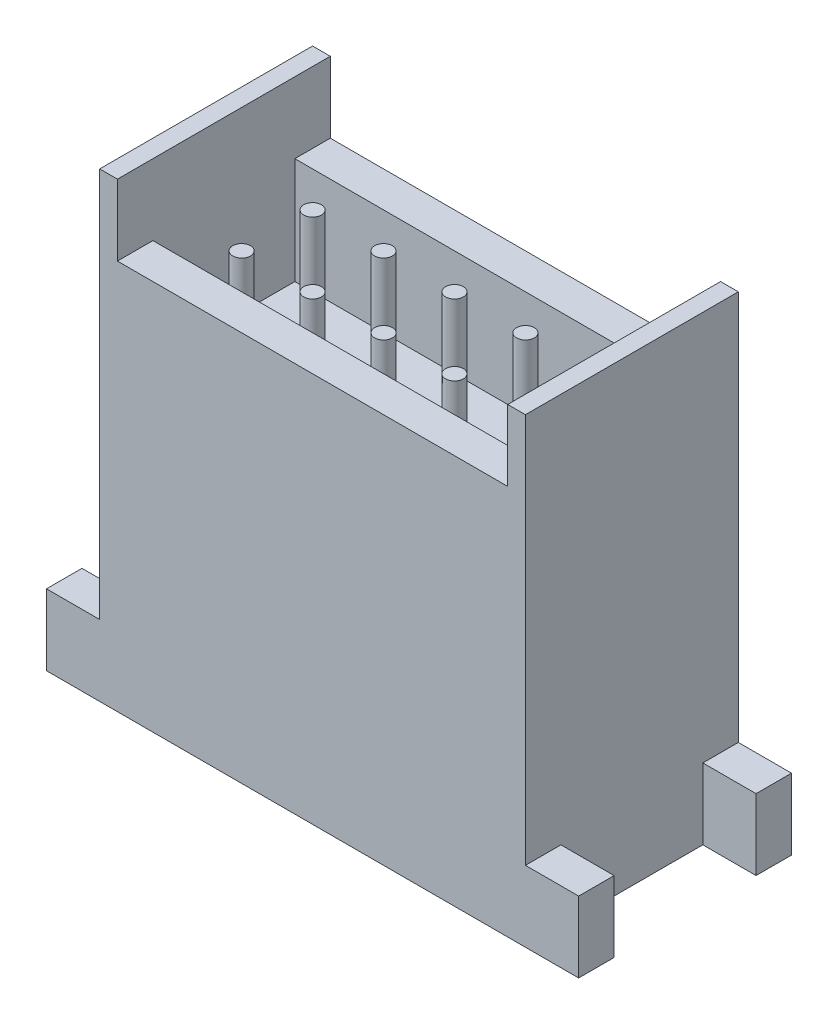
from build123d import *

# Parameters (mm, degrees)
SKETCH1_W           = 12
SKETCH1_H           = 6
BOSS_EXTRUDE1_DEPTH = 13
SKETCH2_W           = 1
SKETCH2_H           = 2
BOSS_EXTRUDE2_DEPTH = 1.5
SKETCH3_W           = 11
SKETCH3_H           = 4
CUT_EXTRUDE1_DEPTH  = 5
SKETCH4_W           = 11
SKETCH4_H           = 1
CUT_EXTRUDE2_DEPTH  = 2
SKETCH5_R           = 0.25
BOSS_EXTRUDE3_DEPTH = 3


with BuildPart() as part:
    # Sketch1 → Boss-Extrude1 (new body)
    with BuildSketch(Plane(origin=(0, 0, 0), x_dir=(1, 0, 0), z_dir=(0, 1, 0))):
        Rectangle(SKETCH1_W, SKETCH1_H)
    extrude(amount=BOSS_EXTRUDE1_DEPTH)

    # Sketch2 → Boss-Extrude2 (add)
    with BuildSketch(Plane(origin=(6, 0, 0), x_dir=(0, 0, -1), z_dir=(1, 0, 0))):
        with Locations((-2.5, 1)):
            Rectangle(SKETCH2_W, SKETCH2_H)
        with Locations((2.5, 1)):
            Rectangle(SKETCH2_W, SKETCH2_H)
    boss_extrude2 = extrude(amount=BOSS_EXTRUDE2_DEPTH)

    # Mirror1: Boss-Extrude2 across plane
    add(boss_extrude2.mirror(Plane(origin=(0, 0, 0), x_dir=(0, 0, 1), z_dir=(1, 0, 0))))

    # Sketch3 → Cut-Extrude1 (cut)
    with BuildSketch(Plane(origin=(0, 13, 0), x_dir=(1, 0, 0), z_dir=(0, 1, 0))):
        Rectangle(SKETCH3_W, SKETCH3_H)
    extrude(amount=-CUT_EXTRUDE1_DEPTH, mode=Mode.SUBTRACT)

    # Sketch4 → Cut-Extrude2 (cut)
    with BuildSketch(Plane(origin=(0, 13, 0), x_dir=(1, 0, 0), z_dir=(0, 1, 0))):
        with Locations((0, 2.5)):
            Rectangle(SKETCH4_W, SKETCH4_H)
        with Locations((0, -2.5)):
            Rectangle(SKETCH4_W, SKETCH4_H)
    extrude(amount=-CUT_EXTRUDE2_DEPTH, mode=Mode.SUBTRACT)

    # Sketch5 → Boss-Extrude3 (add)
    with BuildSketch(Plane(origin=(0, 8, 0), x_dir=(1, 0, 0), z_dir=(0, 1, 0))):
        with Locations((0, 1)):
            Circle(SKETCH5_R)
        with Locations((2, 1)):
            Circle(SKETCH5_R)
        with Locations((4, 1)):
            Circle(SKETCH5_R)
        with Locations((-4, 1)):
            Circle(SKETCH5_R)
        with Locations((-2, 1)):
            Circle(SKETCH5_R)
        with Locations((4, -1)):
            Circle(SKETCH5_R)
        with Locations((2, -1)):
            Circle(SKETCH5_R)
        with Locations((0, -1)):
            Circle(SKETCH5_R)
        with Locations((-2, -1)):
            Circle(SKETCH5_R)
        with Locations((-4, -1)):
            Circle(SKETCH5_R)
    extrude(amount=BOSS_EXTRUDE3_DEPTH)


solid = part.part
